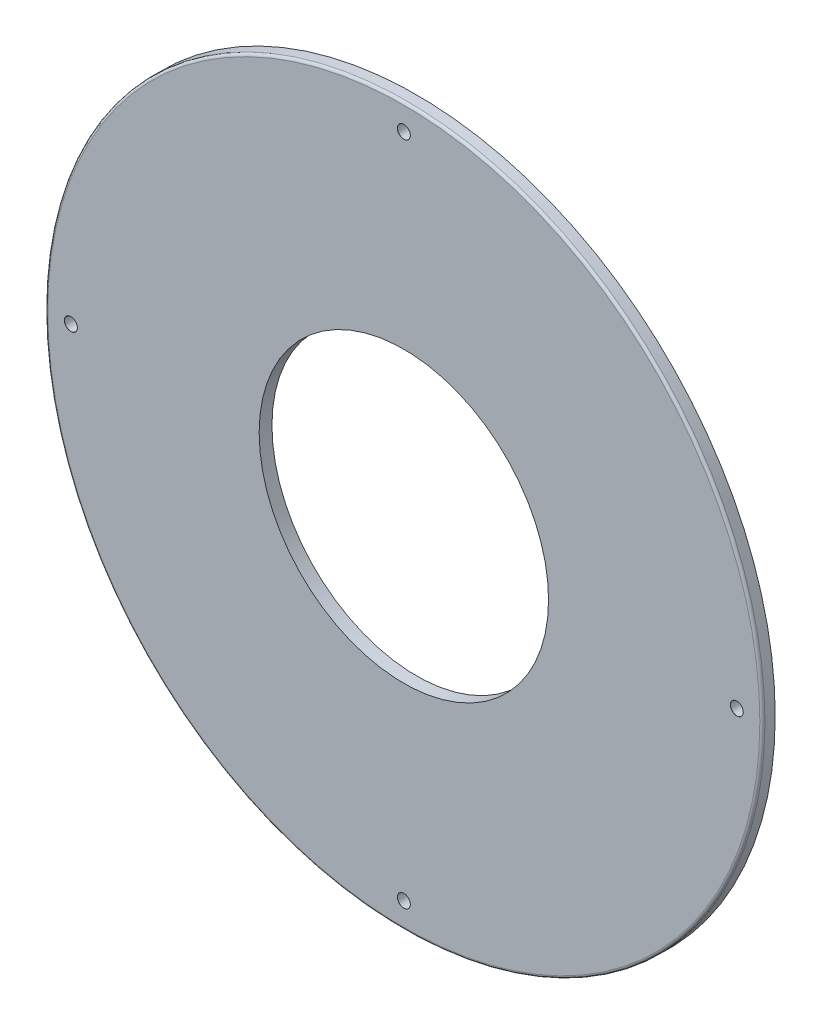
from build123d import *

# Parameters (mm, degrees)
SKETCH1_R                       = 140
SKETCH1_R_2                     = 56.5
BOSS_EXTRUDE1_DEPTH             = 5
F_5_0MM_DOWEL_HOLE1_D           = 5
F_5_0MM_DOWEL_HOLE1_CSINK_D     = 5.05
F_5_0MM_DOWEL_HOLE1_CSINK_ANGLE = 90
FILLET1_R                       = 1
CHAMFER1_SIZE                   = 1


with BuildPart() as part:
    # Sketch1 → Boss-Extrude1 (new body)
    with BuildSketch(Plane.XY):
        Circle(SKETCH1_R)
        Circle(SKETCH1_R_2, mode=Mode.SUBTRACT)
    extrude(amount=BOSS_EXTRUDE1_DEPTH)

    # Ø5.0mm Dowel Hole1 (through all)
    with Locations(Plane.XY.offset(5)):
        with Locations((0, 130), (0, -130), (130, 0), (-130, 0)):
            CounterSinkHole(F_5_0MM_DOWEL_HOLE1_D / 2, F_5_0MM_DOWEL_HOLE1_CSINK_D / 2, counter_sink_angle=F_5_0MM_DOWEL_HOLE1_CSINK_ANGLE)

    # Fillet1
    fillet1_edges = [part.edges().sort_by_distance(p)[0] for p in [
        (-140, 0, 5),
    ]]
    fillet(fillet1_edges, radius=FILLET1_R)

    # Chamfer1
    chamfer1_edges = [part.edges().sort_by_distance(p)[0] for p in [
        (-127.5, 0, 0),
        (132.5, 0, 0),
        (2.5, -130, 0),
        (2.5, 130, 0),
    ]]
    chamfer(chamfer1_edges, length=CHAMFER1_SIZE)


solid = part.part
